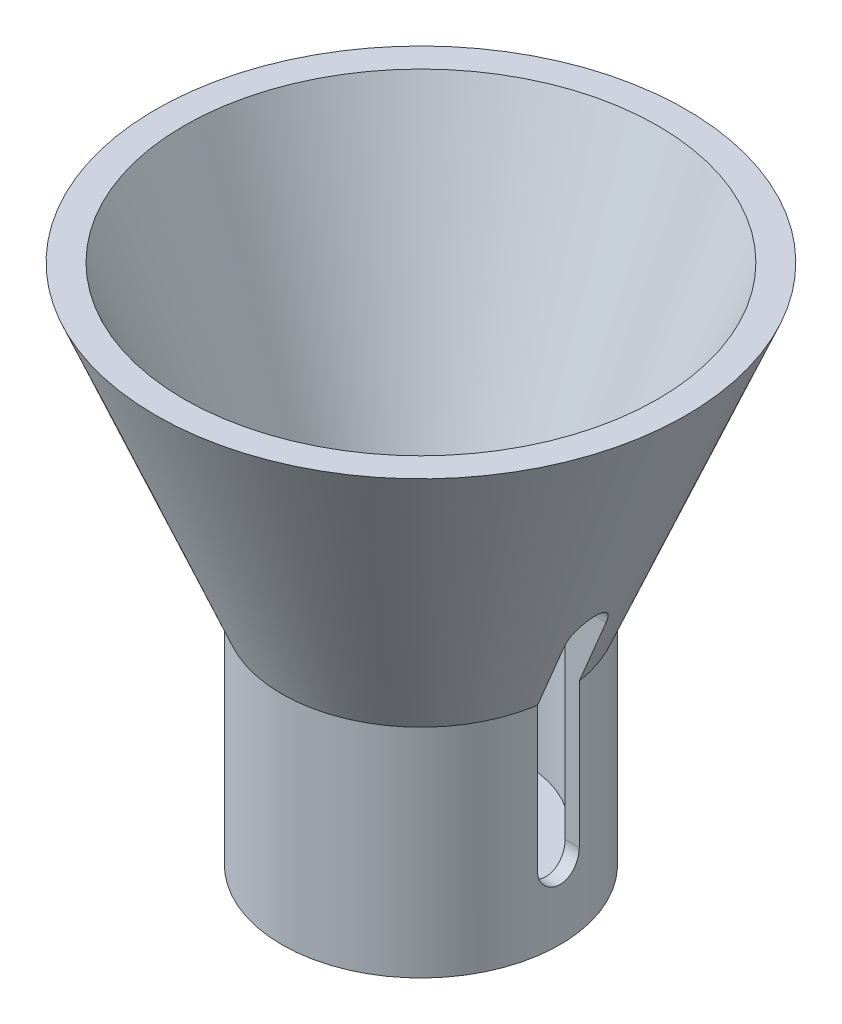
from build123d import *

# Parameters (mm, degrees)
CUT_EXTRUDE1_DEPTH       = 118.311258623
F_0_257_DIAMETER_HOLE1_D = 6.5278
CUT_EXTRUDE2_DEPTH       = 38.1


with BuildPart() as part:
    # Sketch2 → Revolve1 (revolve)
    with BuildSketch(Plane.XY, mode=Mode.PRIVATE) as revolve1_sk:
        Polygon((0, 0), (-25.4, 0), (-25.4, 39.67011582), (-48.421941822, 95.25), (-43.267048969, 95.25), (-22.225, 44.45), (-19.05, 44.45), (-19.05, 6.35), (0, 6.35), align=None)
    revolve(revolve1_sk.sketch.rotate(Axis((0, 0, 0), (0, -1, 0)), 270), axis=Axis((0, 0, 0), (0, -1, 0)))

    # Sketch3 → Cut-Extrude1 (cut, through all)
    with BuildSketch(Plane(origin=(0, 0, 0), x_dir=(0, 0, -1), z_dir=(1, 0, 0))):
        with BuildLine():
            Line((-3.81, 51.435), (-3.81, 13.335))
            ThreePointArc((-3.81, 13.335), (0, 9.525), (3.81, 13.335))
            Line((3.81, 13.335), (3.81, 51.435))
            ThreePointArc((3.81, 51.435), (0, 55.245), (-3.81, 51.435))
        make_face()
    extrude(amount=CUT_EXTRUDE1_DEPTH, mode=Mode.SUBTRACT)

    # F (0.257) Diameter Hole1 (through all)
    with Locations(Plane(origin=(0, 0, 0), x_dir=(-1, 0, 0), z_dir=(0, -1, 0))):
        with Locations((0, 0)):
            Hole(F_0_257_DIAMETER_HOLE1_D / 2)

    # Sketch8 → Cut-Extrude2 (cut, symmetric)
    with BuildSketch(Plane(origin=(0, 44.45, 0), x_dir=(1, 0, 0), z_dir=(0, 1, 0))):
        with BuildLine():
            Line((15.604846444, 10.926631112), (18.725815732, 13.111957335))
            ThreePointArc((18.725815732, 13.111957335), (22.86, 0), (18.725815732, -13.111957335))
            Line((18.725815732, -13.111957335), (15.604846444, -10.926631112))
            ThreePointArc((15.604846444, -10.926631112), (19.05, 0), (15.604846444, 10.926631112))
        make_face()
    extrude(amount=CUT_EXTRUDE2_DEPTH, both=True, mode=Mode.SUBTRACT)


solid = part.part
